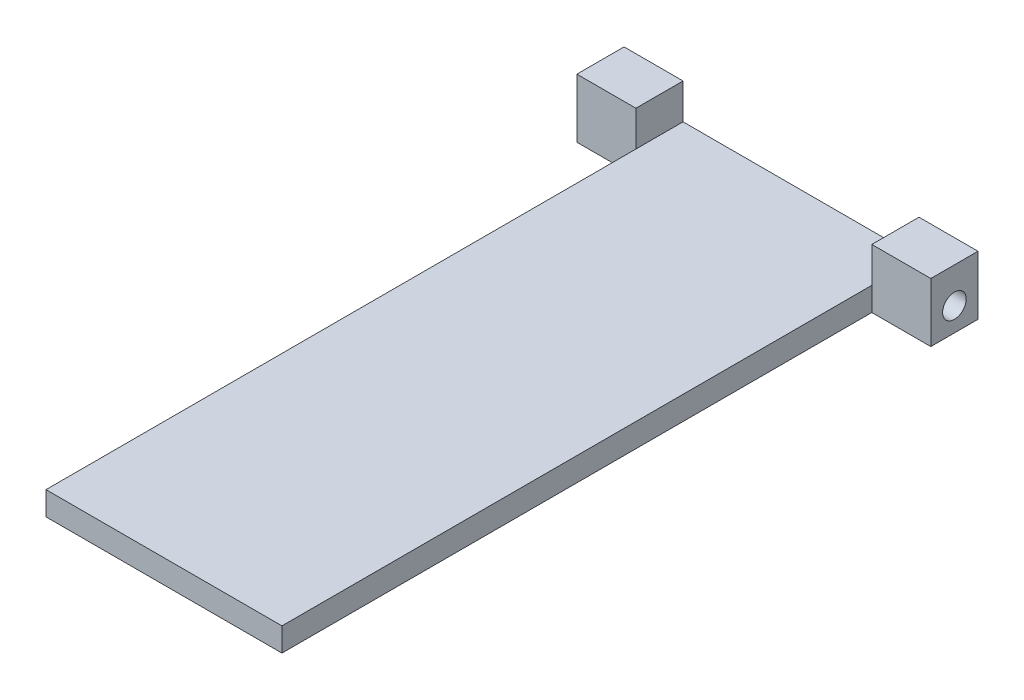
from build123d import *

# Parameters (mm, degrees)
SKETCH5_W           = 100
SKETCH5_H           = 170
BOSS_EXTRUDE2_DEPTH = 10
SKETCH7_W           = 20
SKETCH7_H           = 25
BOSS_EXTRUDE3_DEPTH = 25
SKETCH8_W           = 20
SKETCH8_H           = 25
BOSS_EXTRUDE4_DEPTH = 25
SKETCH11_R          = 5
CUT_EXTRUDE1_DEPTH  = 20
CUT_EXTRUDE2_START  = -20
SKETCH12_R          = 5
CUT_EXTRUDE2_DEPTH  = 20
SKETCH17_W          = 100
SKETCH17_H          = 10
BOSS_EXTRUDE6_DEPTH = 100


with BuildPart() as part:
    # Sketch5 → Boss-Extrude2 (new body)
    with BuildSketch(Plane(origin=(0, -50, 0), x_dir=(-1, 0, 0), z_dir=(0, -1, 0))):
        Rectangle(SKETCH5_W, SKETCH5_H)
    extrude(amount=-BOSS_EXTRUDE2_DEPTH)

    # Sketch7 → Boss-Extrude3 (add)
    with BuildSketch(Plane.ZY.offset(50)):
        with Locations((-75, -37.5)):
            Rectangle(SKETCH7_W, SKETCH7_H)
    extrude(amount=BOSS_EXTRUDE3_DEPTH)

    # Sketch8 → Boss-Extrude4 (add)
    with BuildSketch(Plane(origin=(50, 0, 0), x_dir=(0, 0, -1), z_dir=(1, 0, 0))):
        with Locations((75, -37.5)):
            Rectangle(SKETCH8_W, SKETCH8_H)
    extrude(amount=BOSS_EXTRUDE4_DEPTH)

    # Sketch11 → Cut-Extrude1 (cut)
    with BuildSketch(Plane.ZY.offset(75)):
        with Locations((-75, -40)):
            Circle(SKETCH11_R)
    extrude(amount=-CUT_EXTRUDE1_DEPTH, mode=Mode.SUBTRACT)

    # Sketch12 → Cut-Extrude2 (cut)
    with BuildSketch(Plane(origin=(75, 0, 0), x_dir=(0, 0, -1), z_dir=(1, 0, 0)).offset(CUT_EXTRUDE2_START)):
        with Locations(Location((75, -40, 0), (0, 0, 180))):
            Circle(SKETCH12_R)
    extrude(amount=CUT_EXTRUDE2_DEPTH, mode=Mode.SUBTRACT)

    # Sketch17 → Boss-Extrude6 (add)
    with BuildSketch(Plane.XY.offset(85)):
        with Locations((0, -45)):
            Rectangle(SKETCH17_W, SKETCH17_H)
    extrude(amount=BOSS_EXTRUDE6_DEPTH)


solid = part.part
